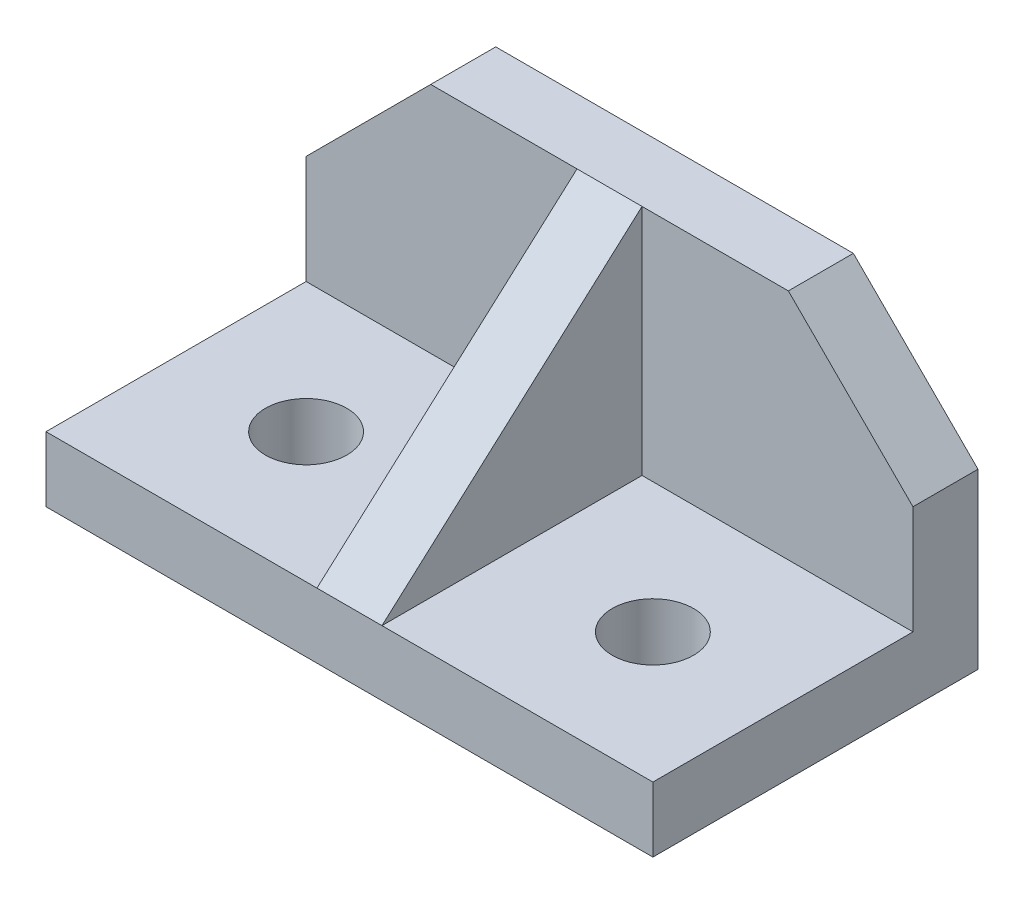
from build123d import *

# Parameters (mm, degrees)
SKETCH1_W           = 112
SKETCH1_H           = 60
SKETCH1_R           = 7.5
BOSS_EXTRUDE1_DEPTH = 12
BOSS_EXTRUDE2_DEPTH = 12
SKETCH3_W           = 12
SKETCH3_H           = 48
BOSS_EXTRUDE3_DEPTH = 43
CUT_EXTRUDE3_DEPTH  = 123


with BuildPart() as part:
    # Sketch1 → Boss-Extrude1 (new body)
    with BuildSketch(Plane(origin=(0, 0, 0), x_dir=(1, 0, 0), z_dir=(0, 1, 0))):
        with Locations((56, 30)):
            Rectangle(SKETCH1_W, SKETCH1_H)
        with Locations(Location((24, 24, 0), (0, 0, 270))):
            Circle(SKETCH1_R, mode=Mode.SUBTRACT)
        with Locations(Location((88, 24, 0), (0, 0, 270))):
            Circle(SKETCH1_R, mode=Mode.SUBTRACT)
    extrude(amount=BOSS_EXTRUDE1_DEPTH)

    # Sketch2 → Boss-Extrude2 (add)
    with BuildSketch(Plane(origin=(0, 0, -60), x_dir=(-1, 0, 0), z_dir=(0, 0, -1))):
        Polygon((0, 12), (0, 32), (-23, 55), (-89, 55), (-112, 32), (-112, 12), align=None)
    extrude(amount=-BOSS_EXTRUDE2_DEPTH)

    # Sketch3 → Boss-Extrude3 (add)
    with BuildSketch(Plane(origin=(0, 12, 0), x_dir=(1, 0, 0), z_dir=(0, 1, 0))):
        with Locations((56, 24)):
            Rectangle(SKETCH3_W, SKETCH3_H)
    extrude(amount=BOSS_EXTRUDE3_DEPTH)

    # Sketch5 → Cut-Extrude3 (cut)
    with BuildSketch(Plane(origin=(62, 0, 0), x_dir=(0, 0, -1), z_dir=(1, 0, 0))):
        Polygon((48, 55), (0, 12), (0, 55), align=None)
    extrude(amount=-CUT_EXTRUDE3_DEPTH, mode=Mode.SUBTRACT)


solid = part.part
